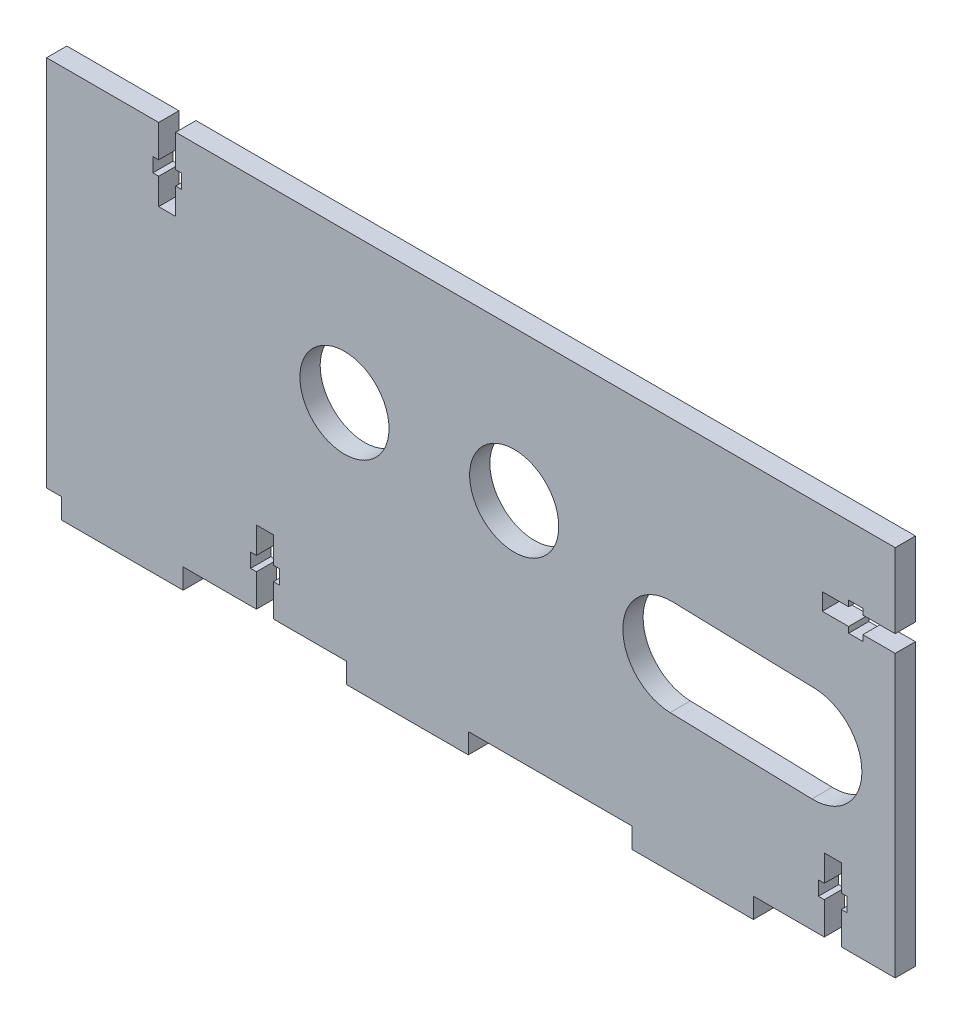
from build123d import *

# Parameters (mm, degrees)
SKETCH1_W           = 230
SKETCH1_H           = 90
BOSS_EXTRUDE1_DEPTH = 5
CUT_EXTRUDE1_REACH  = 125.592
SKETCH2_R           = 11
MOVE_FACE2_BY       = 2
SKETCH3_W           = 8.50990482
SKETCH3_H           = 6
CUT_EXTRUDE2_DEPTH  = 10
BOSS_EXTRUDE2_DEPTH = 5
SKETCH6_W           = 30
SKETCH6_H           = 5
BOSS_EXTRUDE3_DEPTH = 5
SKETCH12_W          = 74.296444361
SKETCH12_H          = 104.356394824
CUT_EXTRUDE6_DEPTH  = 10
CUT_EXTRUDE7_DEPTH  = 10
CUT_EXTRUDE8_DEPTH  = 10


with BuildPart() as part:
    # Sketch1 → Boss-Extrude1 (new body)
    with BuildSketch(Plane.XY):
        Rectangle(SKETCH1_W, SKETCH1_H)
    extrude(amount=BOSS_EXTRUDE1_DEPTH)

    # Sketch2 → Cut-Extrude1 (cut, up to next)
    with BuildSketch(Plane.XY.offset(5), mode=Mode.PRIVATE) as cut_extrude1_sk1:
        with Locations((-20.95, 10)):
            Circle(SKETCH2_R)
    cut_extrude1_tool1 = extrude(cut_extrude1_sk1.sketch, amount=-CUT_EXTRUDE1_REACH, mode=Mode.PRIVATE) & part.part
    # Sketch2 → Cut-Extrude1 (cut, up to next)
    with BuildSketch(Plane.XY.offset(5), mode=Mode.PRIVATE) as cut_extrude1_sk2:
        with Locations((20.95, 10)):
            Circle(SKETCH2_R)
    cut_extrude1_tool2 = extrude(cut_extrude1_sk2.sketch, amount=-CUT_EXTRUDE1_REACH, mode=Mode.PRIVATE) & part.part
    add(cut_extrude1_tool1.solids().sort_by_distance((-20.95, 10, 5))[0], mode=Mode.SUBTRACT)
    add(cut_extrude1_tool2.solids().sort_by_distance((20.95, 10, 5))[0], mode=Mode.SUBTRACT)

    # Move Face2: a face moved outward by 2.0
    extrude(part.faces().sort_by_distance((0, 45, 2.5))[0], amount=MOVE_FACE2_BY, dir=(0, 1, 0))

    # Sketch3 → Cut-Extrude2 (cut)
    with BuildSketch(Plane.XY.offset(5)):
        with Locations((-110.74504759, 44)):
            Rectangle(SKETCH3_W, SKETCH3_H)
    extrude(amount=-CUT_EXTRUDE2_DEPTH, mode=Mode.SUBTRACT)

    # Sketch4 → Boss-Extrude2 (add)
    with BuildSketch(Plane.XY.offset(5)):
        with BuildLine():
            Line((-135.913924796, 10.610415662), (-138.38302872, 1.395594371))
            Line((-138.38302872, 1.395594371), (-142.246732025, 2.430870552))
            Line((-142.246732025, 2.430870552), (-146.129017701, -12.058016843))
            Line((-146.129017701, -12.058016843), (-142.265314396, -13.093293023))
            Line((-142.265314396, -13.093293023), (-144.335866757, -20.820699634))
            Line((-144.335866757, -20.820699634), (-138.540311799, -22.373613904))
            Line((-138.540311799, -22.373613904), (-141.646140341, -33.96472382))
            ThreePointArc((-141.646140341, -33.96472382), (-140.955850397, -37.435045716), (-137.782437035, -39))
            Line((-137.782437035, -39), (-125.782437035, -39))
            Line((-125.782437035, -39), (-125.782437035, -45))
            Line((-125.782437035, -45), (-115, -45))
            Line((-115, -45), (-115, 41))
            Line((-115, 41), (-119.257422168, 41))
            ThreePointArc((-119.257422168, 41), (-121.083706455, 40.380060021), (-122.155199647, 38.776457135))
            Line((-122.155199647, 38.776457135), (-122.353798485, 38.03527618))
            Line((-122.353798485, 38.03527618), (-125.459627027, 26.444166265))
            Line((-125.459627027, 26.444166265), (-131.255181984, 27.997080536))
            Line((-131.255181984, 27.997080536), (-133.325734345, 20.269673925))
            Line((-133.325734345, 20.269673925), (-135.913924796, 10.610415662))
        make_face()
    extrude(amount=-BOSS_EXTRUDE2_DEPTH)

    # Sketch6 → Boss-Extrude3 (add)
    with BuildSketch(Plane.XY.offset(5)):
        with Locations((-75.782437035, -47.5)):
            Rectangle(SKETCH6_W, SKETCH6_H)
        with Locations((-5.391218518, -47.5)):
            Rectangle(SKETCH6_W, SKETCH6_H)
        with Locations((65, -47.5)):
            Rectangle(SKETCH6_W, SKETCH6_H)
    extrude(amount=-BOSS_EXTRUDE3_DEPTH)

    # Sketch12 → Cut-Extrude6 (cut)
    with BuildSketch(Plane.XY.offset(5)):
        with Locations((-131.638317361, -5.178197412)):
            Rectangle(SKETCH12_W, SKETCH12_H)
    extrude(amount=-CUT_EXTRUDE6_DEPTH, mode=Mode.SUBTRACT)

    # Sketch13 → Cut-Extrude7 (cut)
    with BuildSketch(Plane.XY.offset(5)):
        Polygon((-38.486827777, -37), (-37.036827777, -37), (-37.036827777, -33.5), (-38.486827777, -33.5), (-38.486827777, -27), (-42.686827777, -27), (-42.686827777, -33.5), (-44.136827777, -33.5), (-44.136827777, -37), (-42.686827777, -37), (-42.686827777, -45), (-38.486827777, -45), align=None)
        Polygon((101.7, -37), (103.15, -37), (103.15, -33.5), (101.7, -33.5), (101.7, -27), (97.5, -27), (97.5, -33.5), (96.05, -33.5), (96.05, -37), (97.5, -37), (97.5, -45), (101.7, -45), align=None)
        Polygon((107, 28.602956743), (107, 30.052956743), (103.5, 30.052956743), (103.5, 28.602956743), (97, 28.602956743), (97, 24.402956743), (103.5, 24.402956743), (103.5, 22.952956743), (107, 22.952956743), (107, 24.402956743), (115, 24.402956743), (115, 28.602956743), align=None)
        Polygon((-66.809520372, 39), (-68.259520372, 39), (-68.259520372, 35.5), (-66.809520372, 35.5), (-66.809520372, 29), (-62.609520372, 29), (-62.609520372, 35.5), (-61.159520372, 35.5), (-61.159520372, 39), (-62.609520372, 39), (-62.609520372, 47), (-66.809520372, 47), align=None)
    extrude(amount=-CUT_EXTRUDE7_DEPTH, mode=Mode.SUBTRACT)

    # Sketch14 → Cut-Extrude8 (cut)
    with BuildSketch(Plane.XY.offset(5)):
        with BuildLine():
            Line((94.447030587, -16.995566986), (59.447030587, -16.043949671))
            ThreePointArc((59.447030587, -16.043949671), (47.777611866, -3.722234421), (60.099327116, 7.947184301))
            Line((60.099327116, 7.947184301), (95.099327116, 6.995566986))
            ThreePointArc((95.099327116, 6.995566986), (106.768745837, -5.326148264), (94.447030587, -16.995566986))
        make_face()
    extrude(amount=-CUT_EXTRUDE8_DEPTH, mode=Mode.SUBTRACT)


solid = part.part
